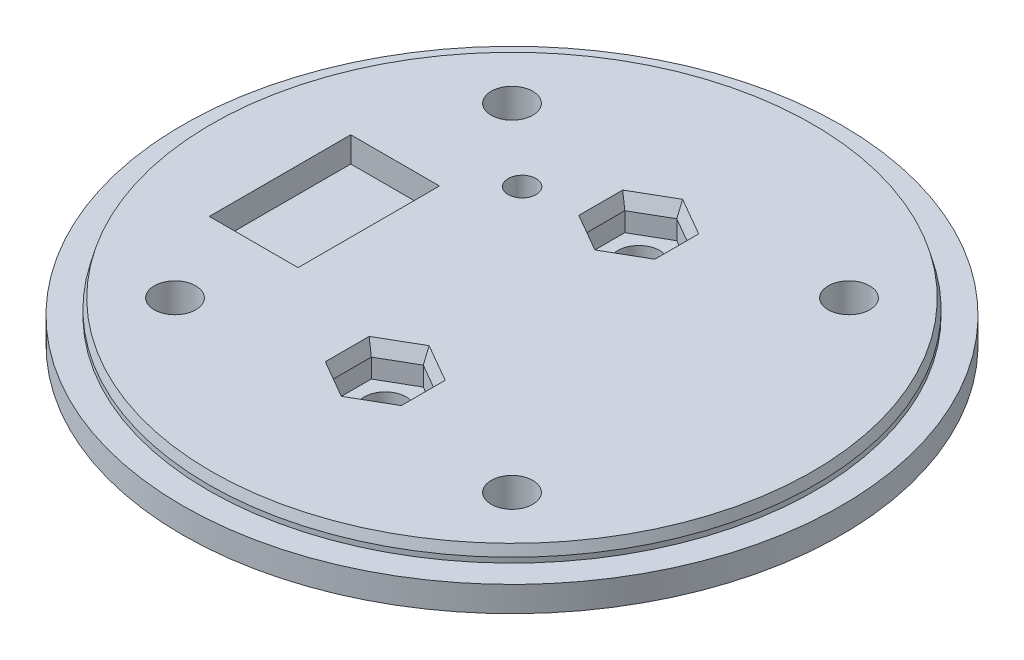
from build123d import *

# Parameters (mm, degrees)
SKETCH_1_R          = 65
EXTRUDE_1_DEPTH     = 5
SKETCH_2_R          = 59.85
EXTRUDE_2_DEPTH     = 3
SKETCH_3_W          = 35
SKETCH_3_H          = 30
EXTRUDE_3_DEPTH     = 25
SKETCH_5_R          = 4.1
CUT_EXTRUDE_2_DEPTH = 96.262794416
SKETCH_6_R          = 2.75
CUT_EXTRUDE_3_DEPTH = 98.667804316
SKETCH2_W           = 20.25
SKETCH2_H           = 10.35
CUT_EXTRUDE1_DEPTH  = 108.964114408
CHAMFER1_SIZE       = 2
CHAMFER1_SIZE2      = 0.535898385
SKETCH4_W           = 35
SKETCH4_H           = 30
CUT_EXTRUDE3_DEPTH  = 12.5
BOSS_EXTRUDE2_START = -2
SKETCH5_W           = 20
SKETCH5_H           = 70
BOSS_EXTRUDE2_DEPTH = 5.325
SKETCH6_R           = 4.15
CUT_EXTRUDE4_DEPTH  = 93.884636108
CUT_EXTRUDE5_DEPTH  = 6.5
CHAMFER2_SIZE       = 1
CHAMFER2_SIZE2      = 2.747477419
SKETCH8_W           = 17.5
SKETCH8_H           = 27.9
CUT_EXTRUDE6_DEPTH  = 5


with BuildPart() as part:
    # Эскиз1 → Бобышка-Вытянуть1 (new body)
    with BuildSketch(Plane(origin=(0, 0, 0), x_dir=(1, 0, 0), z_dir=(0, 1, 0))):
        with Locations(Location((0, 0, 0), (0, 0, 270))):
            Circle(SKETCH_1_R)
    extrude(amount=EXTRUDE_1_DEPTH)

    # Эскиз2 → Бобышка-Вытянуть2 (add)
    with BuildSketch(Plane(origin=(0, 5, 0), x_dir=(1, 0, 0), z_dir=(0, 1, 0))):
        with Locations(Location((0, 0, 0), (0, 0, 270))):
            Circle(SKETCH_2_R)
    extrude(amount=EXTRUDE_2_DEPTH)

    # Эскиз3 → Бобышка-Вытянуть3 (add)
    with BuildSketch(Plane.XZ):
        Rectangle(SKETCH_3_W, SKETCH_3_H)
    extrude(amount=EXTRUDE_3_DEPTH)

    # Эскиз5 → Вырез-Вытянуть2 (cut, through all)
    with BuildSketch(Plane.XZ):
        with Locations(Location((33.234018716, -33.234018716, 0), (0, 0, 270))):
            Circle(SKETCH_5_R)
        with Locations(Location((-33.234018716, -33.234018716, 0), (0, 0, 270))):
            Circle(SKETCH_5_R)
        with Locations(Location((-33.234018716, 33.234018716, 0), (0, 0, 270))):
            Circle(SKETCH_5_R)
        with Locations(Location((33.234018716, 33.234018716, 0), (0, 0, 270))):
            Circle(SKETCH_5_R)
    extrude(amount=-CUT_EXTRUDE_2_DEPTH, mode=Mode.SUBTRACT)

    # Эскиз6 → Вырез-Вытянуть3 (cut, through all)
    with BuildSketch(Plane(origin=(0, 8, 0), x_dir=(1, 0, 0), z_dir=(0, 1, 0))):
        with Locations(Location((-18, 20, 0), (0, 0, 270))):
            Circle(SKETCH_6_R)
    extrude(amount=-CUT_EXTRUDE_3_DEPTH, mode=Mode.SUBTRACT)

    # Sketch2 → Cut-Extrude1 (cut, through all)
    with BuildSketch(Plane.ZY.offset(17.5)):
        with Locations((0, -12.5)):
            Rectangle(SKETCH2_W, SKETCH2_H)
    extrude(amount=-CUT_EXTRUDE1_DEPTH, mode=Mode.SUBTRACT)

    # Chamfer1
    chamfer1_edges = [part.edges().sort_by_distance(p)[0] for p in [
        (0, 8, -59.85),
    ]]
    chamfer1_side = [part.faces().sort_by_distance(p)[0] for p in [
        (0, 6.5, -59.85),
    ]]
    chamfer(chamfer1_edges, length=CHAMFER1_SIZE, length2=CHAMFER1_SIZE2, reference=chamfer1_side[0])

    # Sketch4 → Cut-Extrude3 (cut)
    with BuildSketch(Plane.XZ.offset(25)):
        Rectangle(SKETCH4_W, SKETCH4_H)
    extrude(amount=-CUT_EXTRUDE3_DEPTH, mode=Mode.SUBTRACT)

    # Sketch5 → Boss-Extrude2 (add)
    with BuildSketch(Plane.XZ.offset(7.325).offset(BOSS_EXTRUDE2_START)):
        Rectangle(SKETCH5_W, SKETCH5_H)
    extrude(amount=-BOSS_EXTRUDE2_DEPTH)

    # Sketch6 → Cut-Extrude4 (cut, through all)
    with BuildSketch(Plane.XZ.offset(5.325)):
        with Locations(Location((0, 25, 0), (0, 0, 270))):
            Circle(SKETCH6_R)
        with Locations(Location((0, -25, 0), (0, 0, 270))):
            Circle(SKETCH6_R)
    extrude(amount=-CUT_EXTRUDE4_DEPTH, mode=Mode.SUBTRACT)

    # Sketch7 → Cut-Extrude5 (cut)
    with BuildSketch(Plane(origin=(0, 8, 0), x_dir=(1, 0, 0), z_dir=(0, 1, 0))):
        Polygon((0, -32.5), (6.495190528, -28.75), (6.495190528, -21.25), (0, -17.5), (-6.495190528, -21.25), (-6.495190528, -28.75), align=None)
        Polygon((0, 17.5), (6.495190528, 21.25), (6.495190528, 28.75), (0, 32.5), (-6.495190528, 28.75), (-6.495190528, 21.25), align=None)
    extrude(amount=-CUT_EXTRUDE5_DEPTH, mode=Mode.SUBTRACT)

    # Chamfer2
    chamfer2_edges = [part.edges().sort_by_distance(p)[0] for p in [
        (-3.247595264, 8, 30.625),
        (3.247595264, 8, 30.625),
        (6.495190528, 8, 25),
        (3.247595264, 8, 19.375),
        (-3.247595264, 8, 19.375),
        (-6.495190528, 8, 25),
        (-3.247595264, 8, -19.375),
        (3.247595264, 8, -19.375),
        (6.495190528, 8, -25),
        (3.247595264, 8, -30.625),
        (-3.247595264, 8, -30.625),
        (-6.495190528, 8, -25),
    ]]
    chamfer2_side = [part.faces().sort_by_distance(p)[0] for p in [
        (0.040630406, 8, 0.045144896),
    ]]
    chamfer(chamfer2_edges, length=CHAMFER2_SIZE, length2=CHAMFER2_SIZE2, reference=chamfer2_side[0])

    # Sketch8 → Cut-Extrude6 (cut)
    with BuildSketch(Plane(origin=(0, 8, 0), x_dir=(1, 0, 0), z_dir=(0, 1, 0))):
        with Locations((-35, -2)):
            Rectangle(SKETCH8_W, SKETCH8_H)
    extrude(amount=-CUT_EXTRUDE6_DEPTH, mode=Mode.SUBTRACT)


solid = part.part
